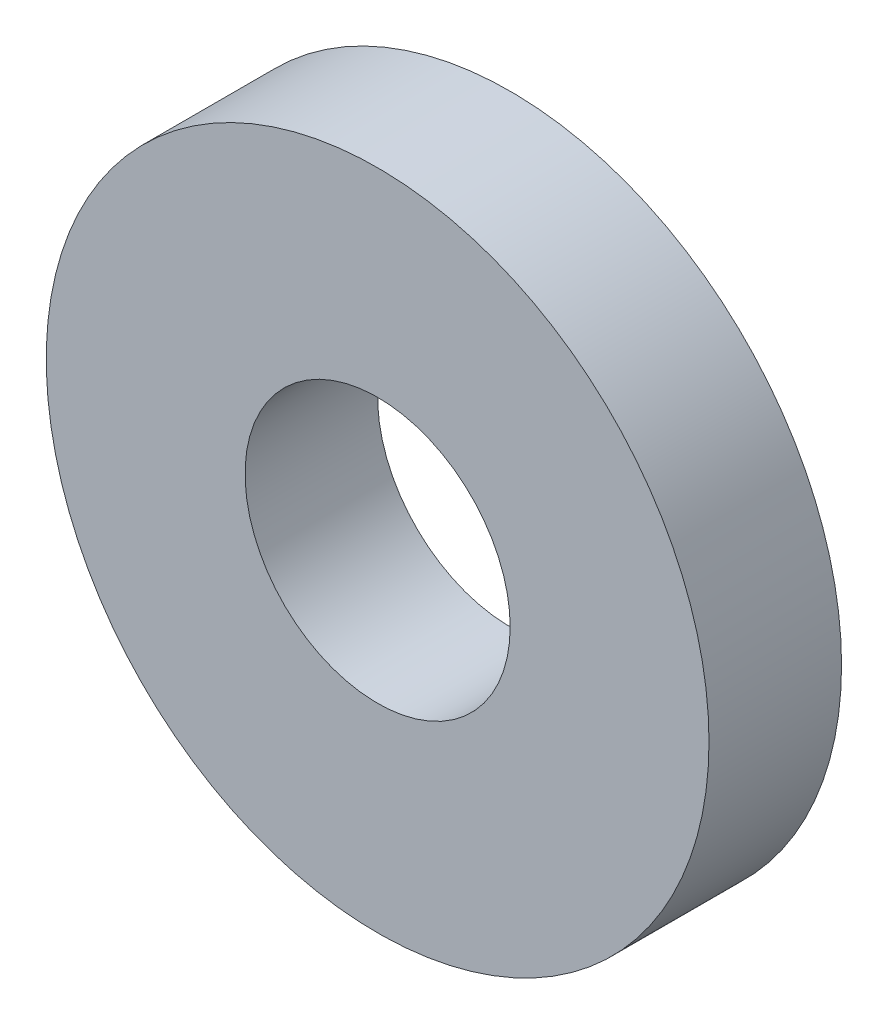
from build123d import *

# Parameters (mm, degrees)
SKETCH_1_R      = 2.5
SKETCH_1_R_2    = 1
EXTRUDE_1_DEPTH = 1


with BuildPart() as part:
    # Эскиз1 → Бобышка-Вытянуть1 (new body)
    with BuildSketch(Plane.XY):
        Circle(SKETCH_1_R)
        Circle(SKETCH_1_R_2, mode=Mode.SUBTRACT)
    extrude(amount=EXTRUDE_1_DEPTH)


solid = part.part
